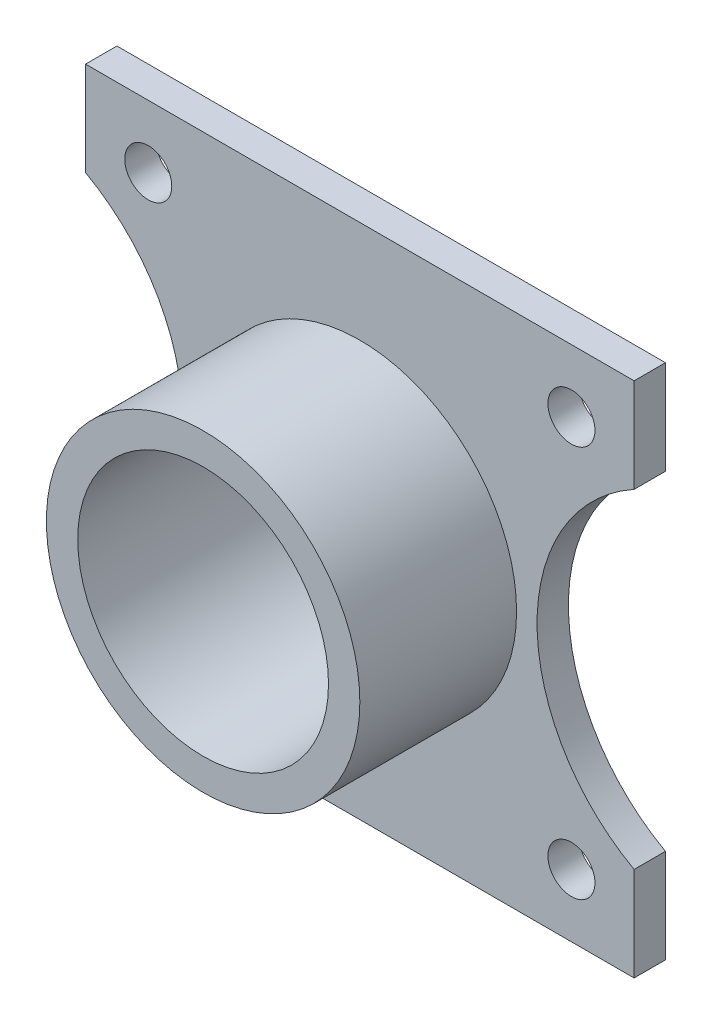
from build123d import *

# Parameters (mm, degrees)
SKETCH_1_R      = 1.5
SKETCH_1_R_2    = 8
EXTRUDE_1_DEPTH = 2
SKETCH_3_R      = 10
SKETCH_3_R_2    = 8
EXTRUDE_2_DEPTH = 10


with BuildPart() as part:
    # 草图1 → 凸台-拉伸1 (new body)
    with BuildSketch(Plane.XY):
        with BuildLine():
            Line((17.5, 16.5), (-17.5, 16.5))
            Line((-17.5, 16.5), (-17.5, 10.5))
            ThreePointArc((-17.5, 10.5), (-11.309475019, 0), (-17.5, -10.5))
            Line((-17.5, -10.5), (-17.5, -16.5))
            Line((-17.5, -16.5), (17.5, -16.5))
            Line((17.5, -16.5), (17.5, -10.5))
            ThreePointArc((17.5, -10.5), (11.309475019, 0), (17.5, 10.5))
            Line((17.5, 10.5), (17.5, 16.5))
        make_face()
        with Locations((-13.5, -12.5)):
            Circle(SKETCH_1_R, mode=Mode.SUBTRACT)
        with Locations((13.5, -12.5)):
            Circle(SKETCH_1_R, mode=Mode.SUBTRACT)
        Circle(SKETCH_1_R_2, mode=Mode.SUBTRACT)
        with Locations((-13.5, 12.5)):
            Circle(SKETCH_1_R, mode=Mode.SUBTRACT)
        with Locations((13.5, 12.5)):
            Circle(SKETCH_1_R, mode=Mode.SUBTRACT)
    extrude(amount=EXTRUDE_1_DEPTH)

    # 草图3 → 凸台-拉伸2 (add)
    with BuildSketch(Plane.XY.offset(2)):
        Circle(SKETCH_3_R)
        Circle(SKETCH_3_R_2, mode=Mode.SUBTRACT)
    extrude(amount=EXTRUDE_2_DEPTH)


solid = part.part
